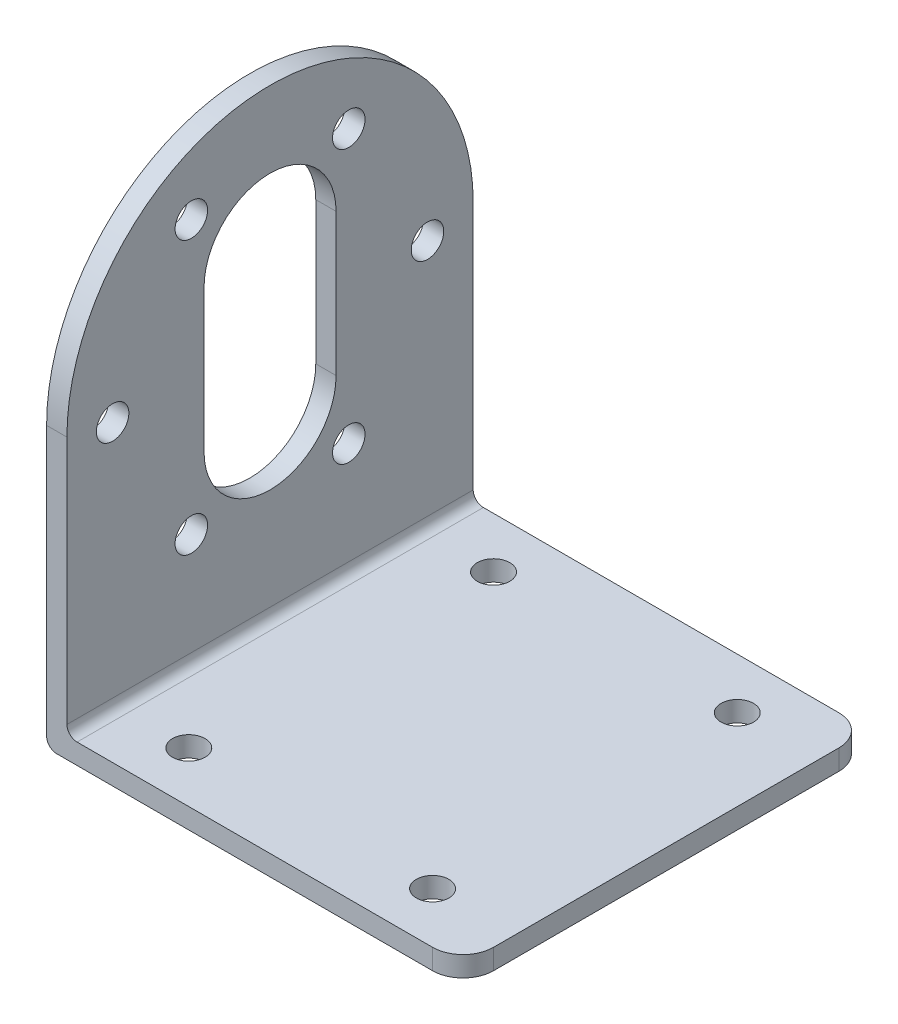
from build123d import *

# Parameters (mm, degrees)
EXTRUDE_1_DEPTH     = 40
FILLET_1_R          = 1
SKETCH_3_R          = 1.6
CUT_EXTRUDE_1_DEPTH = 40
FILLET_2_R          = 3
FILLET_3_RADIUS     = 20
FILLET_3_LENGTH     = 2
SKETCH_4_R          = 1.6
CUT_EXTRUDE_2_DEPTH = 40


with BuildPart() as part:
    # 草图1 → 凸台-拉伸1 (new body)
    with BuildSketch(Plane.XY):
        Polygon((0, 0), (0, 47.5), (2, 47.5), (2, 2), (41, 2), (41, 0), align=None)
    extrude(amount=EXTRUDE_1_DEPTH)

    # 圆角1
    fillet_1_edges = [part.edges().sort_by_distance(p)[0] for p in [
        (0, 0, 20),
        (2, 2, 20),
    ]]
    fillet(fillet_1_edges, radius=FILLET_1_R)

    # 草图3 → 切除-拉伸1 (cut)
    with BuildSketch(Plane.XZ):
        with Locations((33, 35)):
            Circle(SKETCH_3_R)
        with Locations((33, 5)):
            Circle(SKETCH_3_R)
        with Locations((9, 35)):
            Circle(SKETCH_3_R)
        with Locations((9, 5)):
            Circle(SKETCH_3_R)
    extrude(amount=-CUT_EXTRUDE_1_DEPTH, mode=Mode.SUBTRACT)

    # 圆角2
    fillet_2_edges = [part.edges().sort_by_distance(p)[0] for p in [
        (41, 1, 0),
        (41, 1, 40),
    ]]
    fillet(fillet_2_edges, radius=FILLET_2_R)

    # 圆角3: full round fillet: the end face becomes a half cylinder, R = half its width
    fillet_3_face = Plane((1, 47.5, 20), x_dir=(1, 0, 0), z_dir=(0, 1, 0))  # on the end face: x along it, z out of the body
    fillet_3_slab = fillet_3_face.offset(-FILLET_3_RADIUS / 2) * Box(FILLET_3_LENGTH, 2 * FILLET_3_RADIUS, FILLET_3_RADIUS, mode=Mode.PRIVATE)  # the body's end, R deep
    fillet_3_round = Plane((1, 27.5, 20), x_dir=(0, 1, 0), z_dir=(1, 0, 0)) * Cylinder(FILLET_3_RADIUS, FILLET_3_LENGTH, mode=Mode.PRIVATE)  # its axis R under the face
    add(fillet_3_slab - fillet_3_round, mode=Mode.SUBTRACT)

    # 草图4 → 切除-拉伸2 (cut)
    with BuildSketch(Plane.ZY):
        with Locations((35.5, 26.5)):
            Circle(SKETCH_4_R)
        with Locations((27.75, 13.076606241)):
            Circle(SKETCH_4_R)
        with Locations((12.25, 13.076606241)):
            Circle(SKETCH_4_R)
        with Locations((4.5, 26.5)):
            Circle(SKETCH_4_R)
        with Locations((12.25, 39.923393759)):
            Circle(SKETCH_4_R)
        with Locations((27.75, 39.923393759)):
            Circle(SKETCH_4_R)
        with BuildLine():
            Line((13.5, 19.5), (13.5, 33.5))
            ThreePointArc((13.5, 33.5), (20, 40), (26.5, 33.5))
            Line((26.5, 33.5), (26.5, 19.5))
            ThreePointArc((26.5, 19.5), (20, 13), (13.5, 19.5))
        make_face()
    extrude(amount=-CUT_EXTRUDE_2_DEPTH, mode=Mode.SUBTRACT)


solid = part.part
